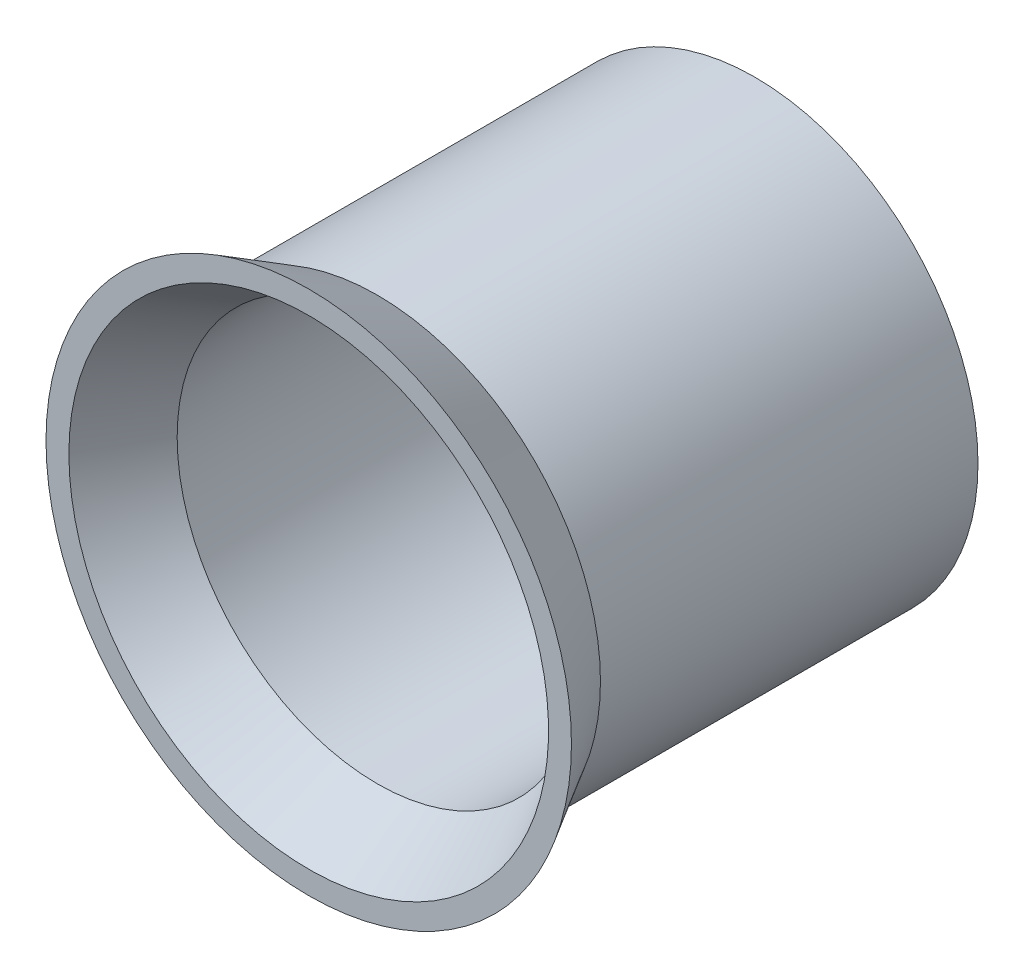
from build123d import *

# Parameters (mm, degrees)
SKETCH1_R           = 19.5
BOSS_EXTRUDE1_DEPTH = 37
SHELL1_T            = -2
SKETCH2_R           = 17.5
SKETCH2_R_2         = 17.1
BOSS_EXTRUDE2_DEPTH = 2
CUT_EXTRUDE1_START  = -4
SKETCH3_R           = 19.5
CUT_EXTRUDE1_DEPTH  = 4


with BuildPart() as part:
    # Sketch1 → Boss-Extrude1 (new body)
    with BuildSketch(Plane.XY):
        Circle(SKETCH1_R)
    extrude(amount=BOSS_EXTRUDE1_DEPTH)

    # Shell1
    shell1_openings = [part.faces().sort_by_distance(p)[0] for p in [
        (0, 0, 37),
    ]]
    offset(amount=SHELL1_T, openings=shell1_openings, kind=Kind.INTERSECTION)

    # Sketch2 → Boss-Extrude2 (add)
    with BuildSketch(Plane.XY.offset(2)):
        Circle(SKETCH2_R)
        Circle(SKETCH2_R_2, mode=Mode.SUBTRACT)
    extrude(amount=BOSS_EXTRUDE2_DEPTH)

    # Sketch3 → Cut-Extrude1 (cut)
    with BuildSketch(Plane.XY.offset(37).offset(CUT_EXTRUDE1_START)):
        Circle(SKETCH3_R)
    extrude(amount=CUT_EXTRUDE1_DEPTH, mode=Mode.SUBTRACT)

    # Sketch4 → Revolve1 (revolve)
    with BuildSketch(Plane(origin=(0, 0, 0), x_dir=(1, 0, 0), z_dir=(0, 1, 0)), mode=Mode.PRIVATE) as revolve1_sk:
        Polygon((19.5, -33), (22.964101615, -39), (20.964101615, -39), (17.5, -33), align=None)
    revolve(revolve1_sk.sketch.rotate(Axis((0, 0, 33), (0, 0, 1)), 180), axis=Axis((0, 0, 33), (0, 0, 1)))


solid = part.part
